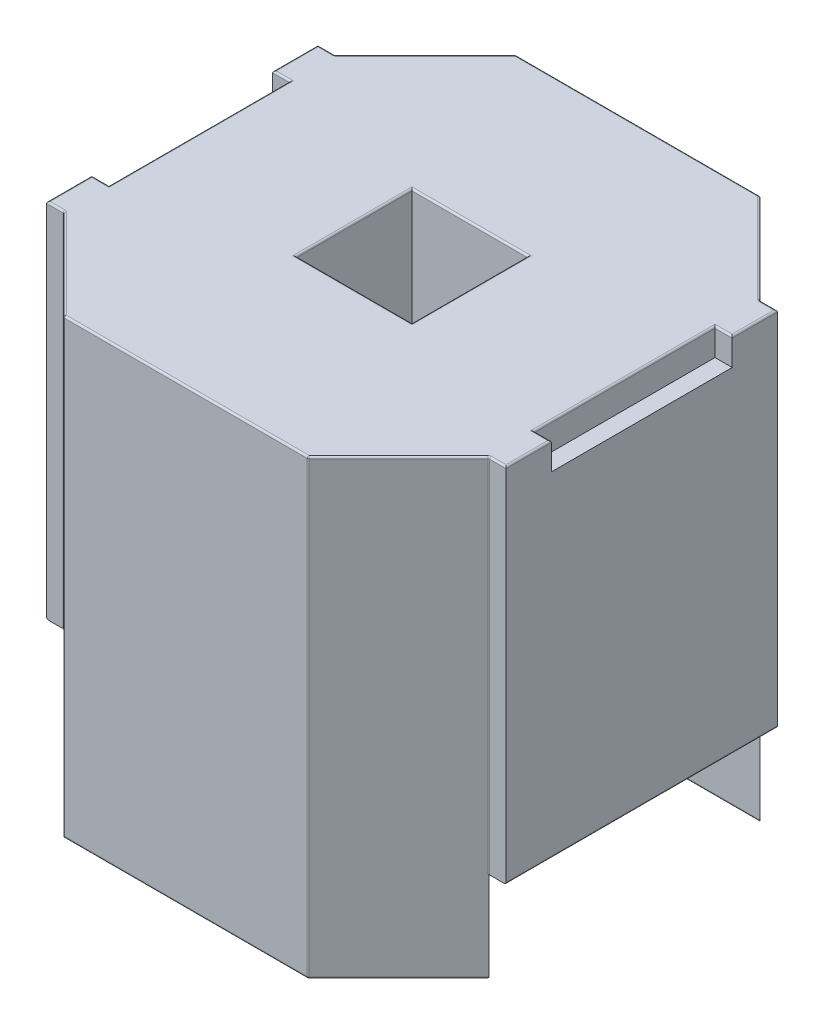
from build123d import *

# Parameters (mm, degrees)
BOSS_EXTRUDE1_DEPTH     = 2.5
SKETCH7_W               = 0.64
SKETCH7_H               = 0.64
CUT_EXTRUDE1_DEPTH      = 4.032016656
SKETCH8_W               = 0.095
SKETCH8_H               = 1.5
BOSS_EXTRUDE2_DEPTH     = 2.5
SKETCH9_W               = 0.095
SKETCH9_H               = 1
CUT_EXTRUDE2_DEPTH      = 0.15
CUT_EXTRUDE3_DEPTH      = 4.776784347
CUT_EXTRUDE3_DEPTH_BACK = 4.776784347
SKETCH12_W              = 1.5
SKETCH12_H              = 0.5
CHAMFER1_SIZE           = 0.4
FILLET1_R               = 0.01


with BuildPart() as part:
    # Sketch5 → Boss-Extrude1 (new body)
    with BuildSketch(Plane(origin=(0, 0, 0), x_dir=(1, 0, 0), z_dir=(0, 1, 0))):
        Polygon((-0.675, 1.25), (-1.175, 0.75), (-1.175, -0.75), (-0.675, -1.25), (0.675, -1.25), (1.175, -0.75), (1.175, 0.75), (0.675, 1.25), align=None)
    extrude(amount=BOSS_EXTRUDE1_DEPTH)

    # Sketch7 → Cut-Extrude1 (cut, through all)
    with BuildSketch(Plane(origin=(0, 2.5, 0), x_dir=(1, 0, 0), z_dir=(0, 1, 0))):
        Rectangle(SKETCH7_W, SKETCH7_H)
    extrude(amount=-CUT_EXTRUDE1_DEPTH, mode=Mode.SUBTRACT)

    # Sketch8 → Boss-Extrude2 (add)
    with BuildSketch(Plane(origin=(0, 2.5, 0), x_dir=(1, 0, 0), z_dir=(0, 1, 0))):
        with Locations((-1.2225, 0)):
            Rectangle(SKETCH8_W, SKETCH8_H)
        with Locations((1.2225, 0)):
            Rectangle(SKETCH8_W, SKETCH8_H)
    extrude(amount=-BOSS_EXTRUDE2_DEPTH)

    # Sketch9 → Cut-Extrude2 (cut)
    with BuildSketch(Plane(origin=(0, 2.5, 0), x_dir=(1, 0, 0), z_dir=(0, 1, 0))):
        with Locations((-1.2225, 0)):
            Rectangle(SKETCH9_W, SKETCH9_H)
        with Locations((1.2225, 0)):
            Rectangle(SKETCH9_W, SKETCH9_H)
    extrude(amount=-CUT_EXTRUDE2_DEPTH, mode=Mode.SUBTRACT)

    # Sketch12 → Cut-Extrude3 (cut, two sides: drawn at the far end of the back side and taken through both)
    with BuildSketch(Plane(origin=(1.27, 0, 0), x_dir=(0, 0, -1), z_dir=(1, 0, 0)).offset(-CUT_EXTRUDE3_DEPTH_BACK)):
        with Locations((0, 0.25)):
            Rectangle(SKETCH12_W, SKETCH12_H)
    extrude(amount=CUT_EXTRUDE3_DEPTH + CUT_EXTRUDE3_DEPTH_BACK, mode=Mode.SUBTRACT)

    # Chamfer1
    chamfer1_edges = [part.edges().sort_by_distance(p)[0] for p in [
        (0, 0.5, -0.32),
        (0.32, 0.5, 0),
        (0, 0.5, 0.32),
        (-0.32, 0.5, 0),
    ]]
    chamfer(chamfer1_edges, length=CHAMFER1_SIZE)

    # Fillet1
    fillet1_edges = [part.edges().sort_by_distance(p)[0] for p in [
        (-1.2225, 2.5, -0.75),
        (-0.925, 2.5, -1),
        (0, 2.5, -1.25),
        (0.925, 2.5, -1),
        (1.2225, 2.5, -0.75),
        (1.27, 2.5, -0.625),
        (1.2225, 2.5, -0.5),
        (1.175, 2.5, 0),
        (1.2225, 2.5, 0.5),
        (1.27, 2.5, 0.625),
        (1.2225, 2.5, 0.75),
        (0.925, 2.5, 1),
        (0, 2.5, 1.25),
        (-0.925, 2.5, 1),
        (-1.2225, 2.5, 0.75),
        (-1.27, 2.5, 0.625),
        (-1.2225, 2.5, 0.5),
        (-1.175, 2.5, 0),
        (-1.2225, 2.5, -0.5),
        (-1.27, 2.5, -0.625),
        (-0.32, 2.5, 0),
        (0, 2.5, 0.32),
        (0.32, 2.5, 0),
        (0, 2.5, -0.32),
        (0.925, 0, -1),
        (-0.925, 0, -1),
        (0, 0, -0.75),
        (-0.925, 0, 1),
        (0.925, 0, 1),
        (0, 0, 0.75),
        (0.675, 1.25, -1.25),
        (-0.675, 1.25, -1.25),
        (0, 0, -1.25),
        (-0.675, 1.25, 1.25),
        (0.675, 1.25, 1.25),
        (0, 0, 1.25),
        (-1.27, 0.5, 0),
        (1.27, 0.5, 0),
        (-1.175, 1.5, -0.75),
        (-1.175, 1.5, 0.75),
        (1.175, 1.5, -0.75),
        (1.175, 1.5, 0.75),
    ]]
    fillet(fillet1_edges, radius=FILLET1_R)


solid = part.part
